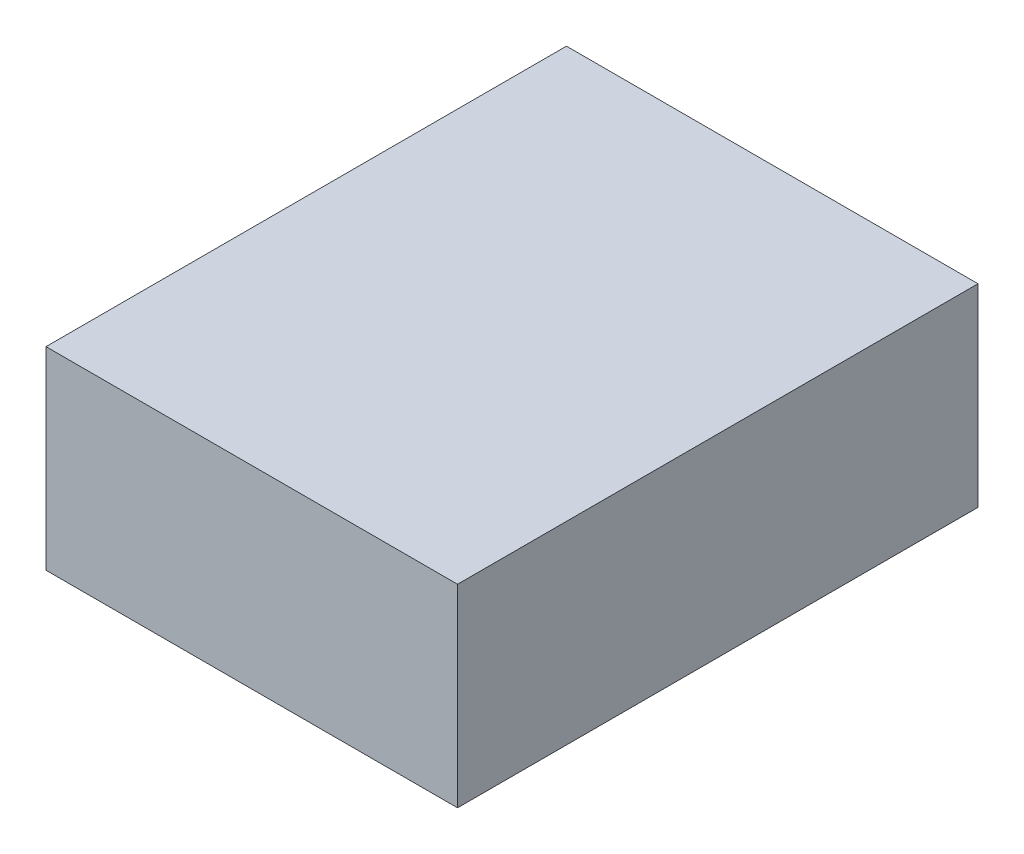
from build123d import *

# Parameters (mm, degrees)
SKETCH1_W           = 340
SKETCH1_H           = 430
BOSS_EXTRUDE1_DEPTH = 160


with BuildPart() as part:
    # Sketch1 → Boss-Extrude1 (new body)
    with BuildSketch(Plane(origin=(0, 0, 0), x_dir=(1, 0, 0), z_dir=(0, 1, 0))):
        Rectangle(SKETCH1_W, SKETCH1_H)
    extrude(amount=BOSS_EXTRUDE1_DEPTH)


solid = part.part
